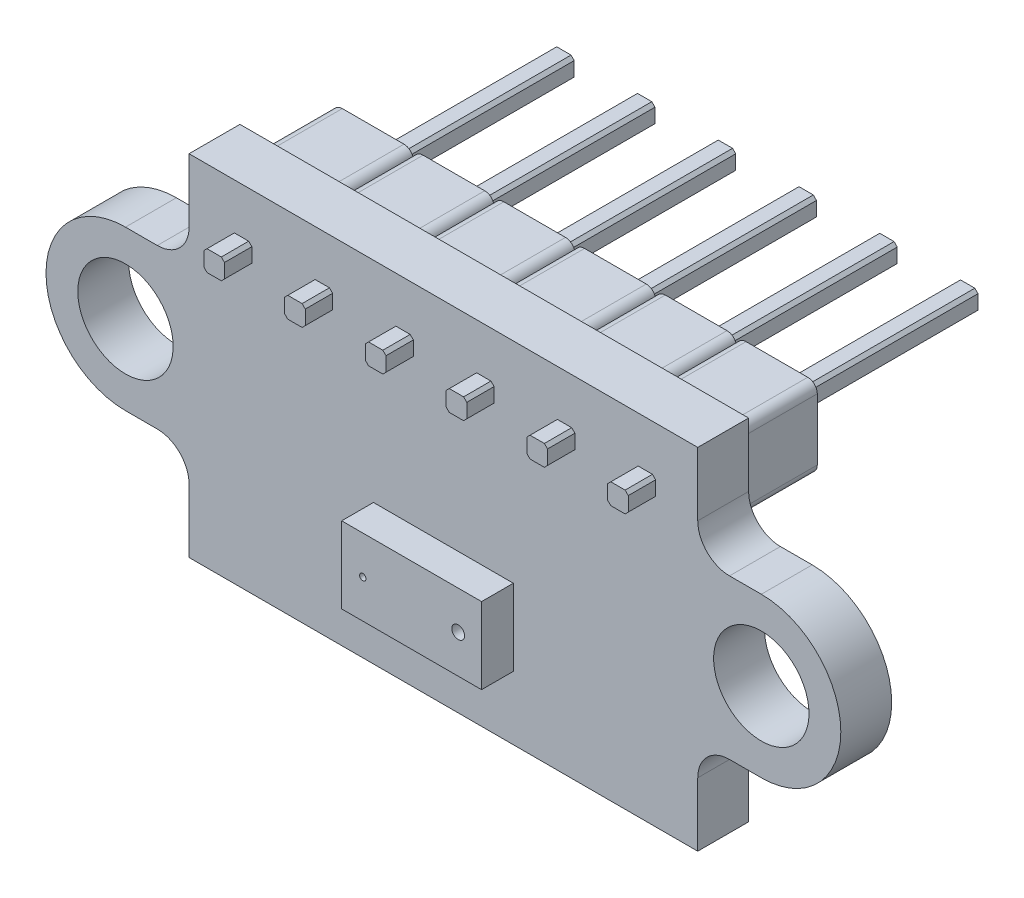
from build123d import *

# Parameters (mm, degrees)
CROQUIS1_R                   = 1.5
SALIENTE_EXTRUIR1_DEPTH      = 1.6
CROQUIS2_W                   = 4.4
CROQUIS2_H                   = 2.4
CROQUIS2_R                   = 0.1
CROQUIS2_R_2                 = 0.2
SALIENTE_EXTRUIR2_DEPTH      = 1
REDONDEO1_R                  = 1
SALIENTE_EXTRUIR3_DEPTH      = 2.54
SALIENTE_EXTRUIR4_DEPTH      = 6
SALIENTE_EXTRUIR4_DEPTH_BACK = 5


with BuildPart() as part:
    # Croquis1 → Saliente-Extruir1 (new body)
    with BuildSketch(Plane.XY):
        with BuildLine():
            Line((-8, -5.5), (8, -5.5))
            Line((8, -5.5), (8, -2.5))
            Line((8, -2.5), (10, -2.5))
            ThreePointArc((10, -2.5), (12.5, 0), (10, 2.5))
            Line((10, 2.5), (8, 2.5))
            Line((8, 2.5), (8, 5.5))
            Line((8, 5.5), (-8, 5.5))
            Line((-8, 5.5), (-8, 2.5))
            Line((-8, 2.5), (-10, 2.5))
            ThreePointArc((-10, 2.5), (-12.5, 0), (-10, -2.5))
            Line((-10, -2.5), (-8, -2.5))
            Line((-8, -2.5), (-8, -5.5))
        make_face()
        with Locations((10, 0)):
            Circle(CROQUIS1_R, mode=Mode.SUBTRACT)
        with Locations(Location((-10, 0, 0), (0, 0, 180))):
            Circle(CROQUIS1_R, mode=Mode.SUBTRACT)
    extrude(amount=SALIENTE_EXTRUIR1_DEPTH)

    # Croquis2 → Saliente-Extruir2 (add)
    with BuildSketch(Plane.XY.offset(1.6)):
        with Locations((0, -2.3)):
            Rectangle(CROQUIS2_W, CROQUIS2_H)
        with Locations((-1.535, -2.3)):
            Circle(CROQUIS2_R, mode=Mode.SUBTRACT)
        with Locations((1.465, -2.3)):
            Circle(CROQUIS2_R_2, mode=Mode.SUBTRACT)
    extrude(amount=SALIENTE_EXTRUIR2_DEPTH)

    # Redondeo1
    redondeo1_edges = [part.edges().sort_by_distance(p)[0] for p in [
        (8, 2.5, 0.8),
        (8, -2.5, 0.8),
        (-8, -2.5, 0.8),
        (-8, 2.5, 0.8),
    ]]
    fillet(redondeo1_edges, radius=REDONDEO1_R)

    # Croquis3 → Saliente-Extruir3 (add)
    with BuildSketch(Plane(origin=(0, 0, 0), x_dir=(-1, 0, 0), z_dir=(0, 0, -1))):
        with BuildLine():
            Line((0.3, 2.46), (2.24, 2.46))
            ThreePointArc((2.24, 2.46), (2.452132034, 2.547867966), (2.54, 2.76))
            ThreePointArc((2.54, 2.76), (2.627867966, 2.547867966), (2.84, 2.46))
            Line((2.84, 2.46), (4.78, 2.46))
            ThreePointArc((4.78, 2.46), (4.992132034, 2.547867966), (5.08, 2.76))
            ThreePointArc((5.08, 2.76), (5.167867966, 2.547867966), (5.38, 2.46))
            Line((5.38, 2.46), (7.32, 2.46))
            ThreePointArc((7.32, 2.46), (7.532132034, 2.547867966), (7.62, 2.76))
            Line((7.62, 2.76), (7.62, 4.7))
            ThreePointArc((7.62, 4.7), (7.532132034, 4.912132034), (7.32, 5))
            Line((7.32, 5), (5.38, 5))
            ThreePointArc((5.38, 5), (5.167867966, 4.912132034), (5.08, 4.7))
            ThreePointArc((5.08, 4.7), (4.992132034, 4.912132034), (4.78, 5))
            Line((4.78, 5), (2.84, 5))
            ThreePointArc((2.84, 5), (2.627867966, 4.912132034), (2.54, 4.7))
            ThreePointArc((2.54, 4.7), (2.452132034, 4.912132034), (2.24, 5))
            Line((2.24, 5), (0.3, 5))
            ThreePointArc((0.3, 5), (0.087867966, 4.912132034), (0, 4.7))
            ThreePointArc((0, 4.7), (-0.087867966, 4.912132034), (-0.3, 5))
            Line((-0.3, 5), (-2.24, 5))
            ThreePointArc((-2.24, 5), (-2.452132034, 4.912132034), (-2.54, 4.7))
            ThreePointArc((-2.54, 4.7), (-2.627867966, 4.912132034), (-2.84, 5))
            Line((-2.84, 5), (-4.78, 5))
            ThreePointArc((-4.78, 5), (-4.992132034, 4.912132034), (-5.08, 4.7))
            ThreePointArc((-5.08, 4.7), (-5.167867966, 4.912132034), (-5.38, 5))
            Line((-5.38, 5), (-7.32, 5))
            ThreePointArc((-7.32, 5), (-7.532132034, 4.912132034), (-7.62, 4.7))
            Line((-7.62, 4.7), (-7.62, 2.76))
            ThreePointArc((-7.62, 2.76), (-7.532132034, 2.547867966), (-7.32, 2.46))
            Line((-7.32, 2.46), (-5.38, 2.46))
            ThreePointArc((-5.38, 2.46), (-5.167867966, 2.547867966), (-5.08, 2.76))
            ThreePointArc((-5.08, 2.76), (-4.992132034, 2.547867966), (-4.78, 2.46))
            Line((-4.78, 2.46), (-2.84, 2.46))
            ThreePointArc((-2.84, 2.46), (-2.627867966, 2.547867966), (-2.54, 2.76))
            ThreePointArc((-2.54, 2.76), (-2.452132034, 2.547867966), (-2.24, 2.46))
            Line((-2.24, 2.46), (-0.3, 2.46))
            ThreePointArc((-0.3, 2.46), (-0.087867966, 2.547867966), (0, 2.76))
            ThreePointArc((0, 2.76), (0.087867966, 2.547867966), (0.3, 2.46))
        make_face()
    extrude(amount=SALIENTE_EXTRUIR3_DEPTH)

    # Croquis4 → Saliente-Extruir4 (add, two sides: drawn at the far end of the back side and taken through both)
    with BuildSketch(Plane(origin=(0, 0, -2.54), x_dir=(-1, 0, 0), z_dir=(0, 0, -1)).offset(-SALIENTE_EXTRUIR4_DEPTH_BACK)):
        Polygon((6.025, 3.505), (6.025, 3.955), (6.125, 4.055), (6.575, 4.055), (6.675, 3.955), (6.675, 3.505), (6.575, 3.405), (6.125, 3.405), align=None)
        Polygon((3.485, 3.505), (3.485, 3.955), (3.585, 4.055), (4.035, 4.055), (4.135, 3.955), (4.135, 3.505), (4.035, 3.405), (3.585, 3.405), align=None)
        Polygon((0.945, 3.505), (0.945, 3.955), (1.045, 4.055), (1.495, 4.055), (1.595, 3.955), (1.595, 3.505), (1.495, 3.405), (1.045, 3.405), align=None)
        Polygon((-4.135, 3.505), (-4.135, 3.955), (-4.035, 4.055), (-3.585, 4.055), (-3.485, 3.955), (-3.485, 3.505), (-3.585, 3.405), (-4.035, 3.405), align=None)
        Polygon((-1.595, 3.505), (-1.595, 3.955), (-1.495, 4.055), (-1.045, 4.055), (-0.945, 3.955), (-0.945, 3.505), (-1.045, 3.405), (-1.495, 3.405), align=None)
        Polygon((-6.675, 3.505), (-6.675, 3.955), (-6.575, 4.055), (-6.125, 4.055), (-6.025, 3.955), (-6.025, 3.505), (-6.125, 3.405), (-6.575, 3.405), align=None)
    extrude(amount=SALIENTE_EXTRUIR4_DEPTH + SALIENTE_EXTRUIR4_DEPTH_BACK)


solid = part.part
